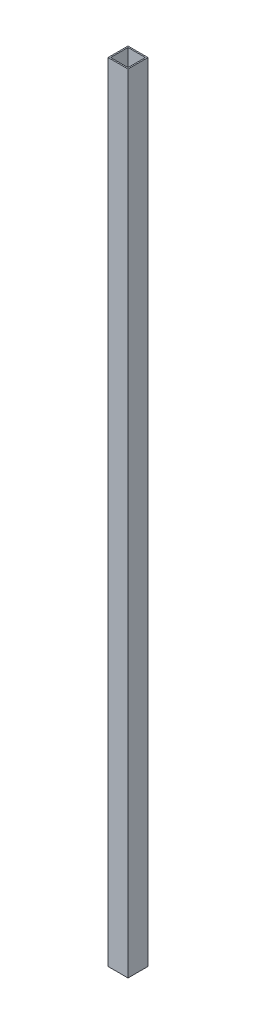
from build123d import *

# Parameters (mm, degrees)
SKETCH1_W           = 25.4
SKETCH1_H           = 25.4
SKETCH1_W_2         = 22.225
SKETCH1_H_2         = 22.225
BOSS_EXTRUDE1_DEPTH = 1003.3


with BuildPart() as part:
    # Sketch1 → Boss-Extrude1 (new body)
    with BuildSketch(Plane(origin=(0, 0, 0), x_dir=(1, 0, 0), z_dir=(0, 1, 0))):
        Rectangle(SKETCH1_W, SKETCH1_H)
        Rectangle(SKETCH1_W_2, SKETCH1_H_2, mode=Mode.SUBTRACT)
    extrude(amount=BOSS_EXTRUDE1_DEPTH)


solid = part.part
